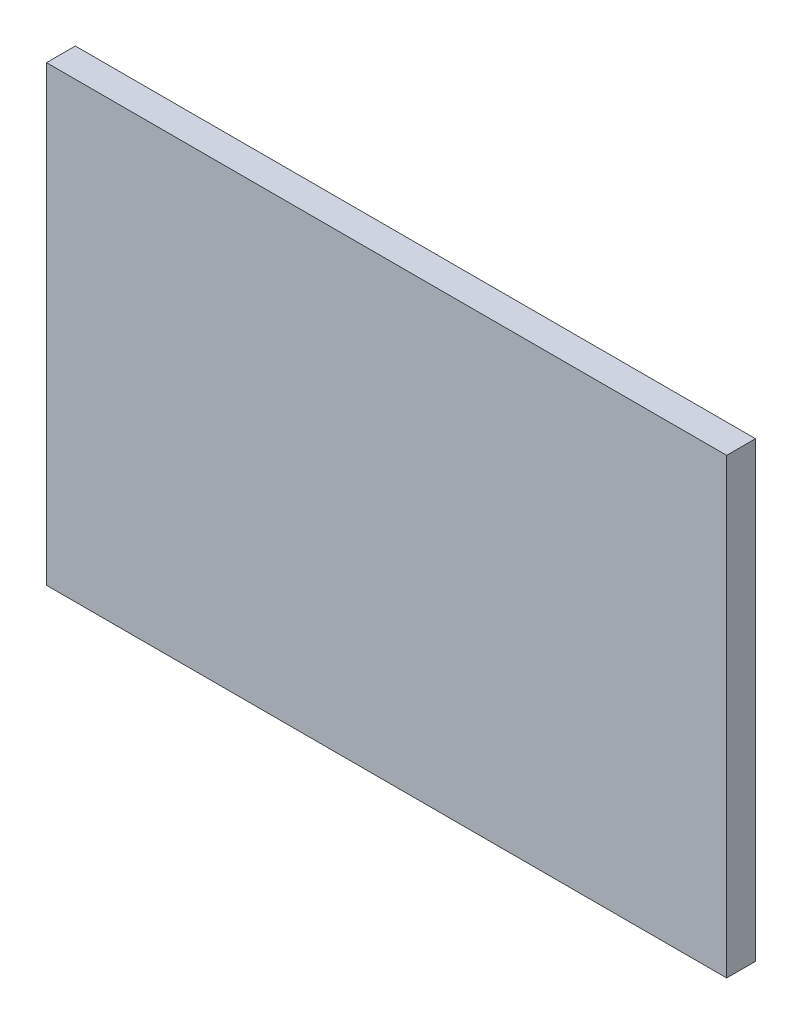
from build123d import *

# Parameters (mm, degrees)
SKETCH_1_W      = 84.96
SKETCH_1_H      = 56.54
EXTRUDE_1_DEPTH = 3.6


with BuildPart() as part:
    # Эскиз1 → Бобышка-Вытянуть1 (new body)
    with BuildSketch(Plane.XY):
        Rectangle(SKETCH_1_W, SKETCH_1_H)
    extrude(amount=EXTRUDE_1_DEPTH)


solid = part.part
